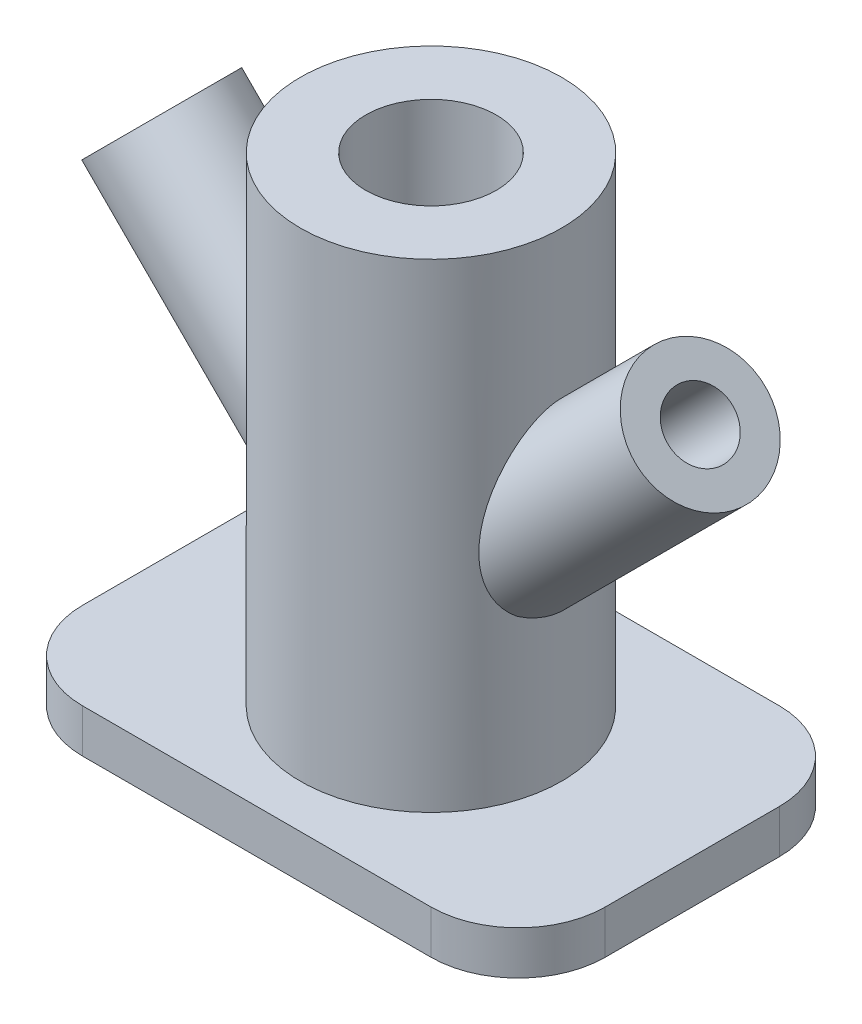
from build123d import *

# Parameters (mm, degrees)
CROQUIS1_W              = 120
CROQUIS1_H              = 80
SALIENTE_EXTRUIR1_DEPTH = 10
REDONDEO1_R             = 20
CROQUIS2_R              = 30
SALIENTE_EXTRUIR3_DEPTH = 120
CROQUIS6_R              = 15
SALIENTE_EXTRUIR4_DEPTH = 59
CROQUIS7_R              = 7.5
CORTAR_EXTRUIR1_DEPTH   = 64
CROQUIS8_R              = 15
CORTAR_EXTRUIR2_DEPTH   = 150
CROQUIS9_R              = 7.5
CORTAR_EXTRUIR3_DEPTH   = 83
CROQUIS10_R             = 15
SALIENTE_EXTRUIR5_DEPTH = 61
CROQUIS11_R             = 7.5
CORTAR_EXTRUIR4_DEPTH   = 78
CROQUIS12_R             = 15
CORTAR_EXTRUIR5_DEPTH   = 134


with BuildPart() as part:
    # Croquis1 → Saliente-Extruir1 (new body)
    with BuildSketch(Plane(origin=(0, 0, 0), x_dir=(1, 0, 0), z_dir=(0, 1, 0))):
        Rectangle(CROQUIS1_W, CROQUIS1_H)
    extrude(amount=SALIENTE_EXTRUIR1_DEPTH)

    # Redondeo1
    redondeo1_edges = [part.edges().sort_by_distance(p)[0] for p in [
        (60, 5, 40),
        (-60, 5, 40),
        (-60, 5, -40),
        (60, 5, -40),
    ]]
    fillet(redondeo1_edges, radius=REDONDEO1_R)

    # Croquis2 → Saliente-Extruir3 (add)
    with BuildSketch(Plane(origin=(0, 0, 0), x_dir=(1, 0, 0), z_dir=(0, 1, 0))):
        with Locations(Location((0, 0, 0), (0, 0, 90))):
            Circle(CROQUIS2_R)
    extrude(amount=SALIENTE_EXTRUIR3_DEPTH)

    # Croquis6 → Saliente-Extruir4 (add)
    with BuildSketch(Plane(origin=(79.319805153, 79.319805153, 0), x_dir=(0, 0, -1), z_dir=(0.7071067811865487, 0.7071067811865464, 0))):
        with Locations(Location((0, 24.748737342, 0), (0, 0, 90))):
            Circle(CROQUIS6_R)
    extrude(amount=-SALIENTE_EXTRUIR4_DEPTH)

    # Croquis7 → Cortar-Extruir1 (cut)
    with BuildSketch(Plane(origin=(79.319805153, 79.319805153, 0), x_dir=(0, 0, -1), z_dir=(0.7071067811865487, 0.7071067811865464, 0))):
        with Locations(Location((0, 24.748737342, 0), (0, 0, 90))):
            Circle(CROQUIS7_R)
    extrude(amount=-CORTAR_EXTRUIR1_DEPTH, mode=Mode.SUBTRACT)

    # Croquis8 → Cortar-Extruir2 (cut)
    with BuildSketch(Plane(origin=(0, 120, 0), x_dir=(1, 0, 0), z_dir=(0, 1, 0))):
        with Locations(Location((0, 0, 0), (0, 0, 270))):
            Circle(CROQUIS8_R)
    extrude(amount=-CORTAR_EXTRUIR2_DEPTH, mode=Mode.SUBTRACT)

    # Croquis9 → Cortar-Extruir3 (cut)
    with BuildSketch(Plane(origin=(79.319805153, 79.319805153, 0), x_dir=(0, 0, -1), z_dir=(0.7071067811865487, 0.7071067811865464, 0))):
        with Locations(Location((0, 24.748737342, 0), (0, 0, 90))):
            Circle(CROQUIS9_R)
    extrude(amount=-CORTAR_EXTRUIR3_DEPTH, mode=Mode.SUBTRACT)

    # Croquis10 → Saliente-Extruir5 (add)
    with BuildSketch(Plane(origin=(-79.319805153, 79.319805153, 0), x_dir=(0.7071067811865477, 0.7071067811865475, 0), z_dir=(-0.7071067811865475, 0.7071067811865477, 0))):
        with Locations(Location((24.748737342, 0, 0), (0, 0, 180))):
            Circle(CROQUIS10_R)
    extrude(amount=-SALIENTE_EXTRUIR5_DEPTH)

    # Croquis11 → Cortar-Extruir4 (cut)
    with BuildSketch(Plane(origin=(-79.319805153, 79.319805153, 0), x_dir=(0.7071067811865477, 0.7071067811865475, 0), z_dir=(-0.7071067811865475, 0.7071067811865477, 0))):
        with Locations(Location((24.748737342, 0, 0), (0, 0, 180))):
            Circle(CROQUIS11_R)
    extrude(amount=-CORTAR_EXTRUIR4_DEPTH, mode=Mode.SUBTRACT)

    # Croquis12 → Cortar-Extruir5 (cut)
    with BuildSketch(Plane(origin=(0, 120, 0), x_dir=(1, 0, 0), z_dir=(0, 1, 0))):
        with Locations(Location((0, 0, 0), (0, 0, 270))):
            Circle(CROQUIS12_R)
    extrude(amount=-CORTAR_EXTRUIR5_DEPTH, mode=Mode.SUBTRACT)


solid = part.part
